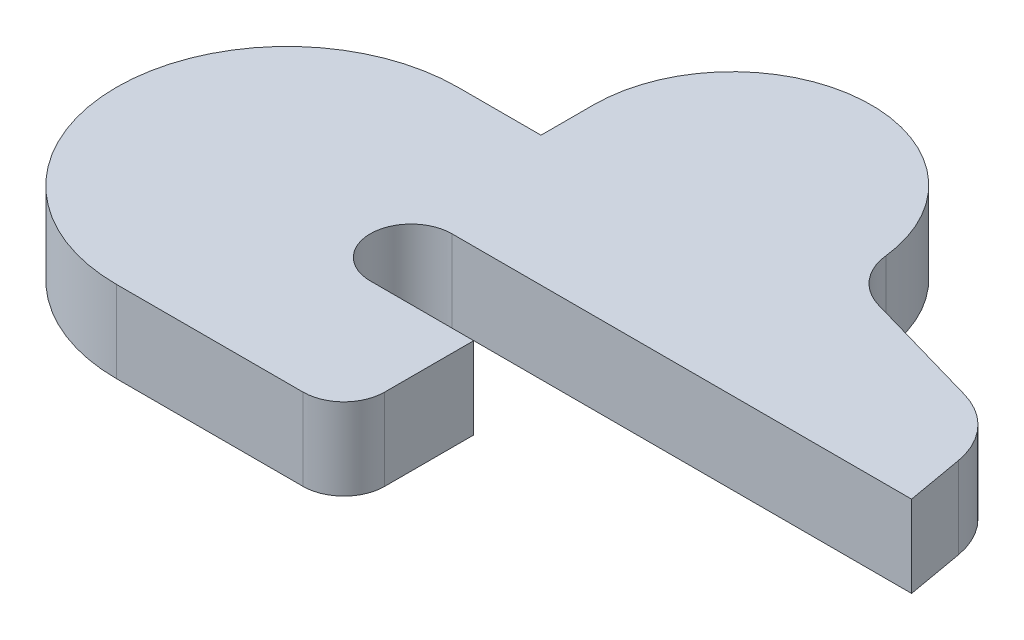
from build123d import *

# Parameters (mm, degrees)
BOSS_EXTRUDE2_DEPTH = 3


with BuildPart() as part:
    # Sketch1 → Boss-Extrude2 (new body)
    with BuildSketch(Plane(origin=(0, 0, 0), x_dir=(1, 0, 0), z_dir=(0, 1, 0))):
        with BuildLine():
            Line((0, 0), (-3.8, 0))
            ThreePointArc((-3.8, 0), (-5.3, 1.5), (-3.8, 3))
            Line((-3.8, 3), (13.079508049, 3))
            Line((13.079508049, 3), (12.710638186, 5.091964944))
            ThreePointArc((12.710638186, 5.091964944), (12.033981989, 6.479315744), (10.724961074, 7.297282795))
            Line((10.724961074, 7.297282795), (6.304706774, 8.56477032))
            ThreePointArc((6.304706774, 8.56477032), (5.328202228, 9.196599891), (4.868381067, 10.264932347))
            ThreePointArc((4.868381067, 10.264932347), (-0.48395119, 14.79), (-5.3, 9.697910869))
            Line((-5.3, 9.697910869), (-5.3, 7.77))
            Line((-5.3, 7.77), (-8.350491951, 7.77))
            ThreePointArc((-8.350491951, 7.77), (-14.620491951, 1.5), (-8.350491951, -4.77))
            Line((-8.350491951, -4.77), (-1.5, -4.77))
            ThreePointArc((-1.5, -4.77), (-0.439339828, -4.330660172), (0, -3.27))
            Line((0, -3.27), (0, 0))
        make_face()
    extrude(amount=BOSS_EXTRUDE2_DEPTH)


solid = part.part
